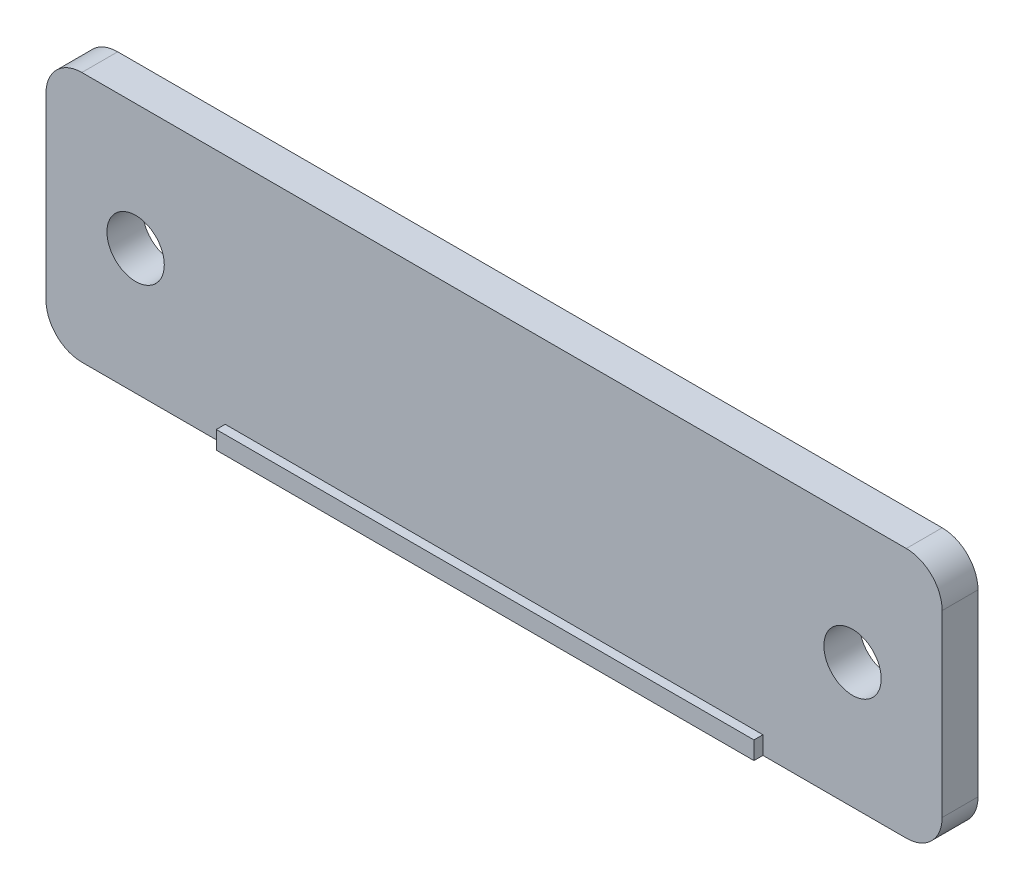
from build123d import *

# Parameters (mm, degrees)
SKETCH2_W           = 50
SKETCH2_H           = 14
BOSS_EXTRUDE1_DEPTH = 2.5
SKETCH4_OUTSIDE_W   = 62.396
SKETCH4_OUTSIDE_H   = 26.396
SKETCH4_OUTSIDE_W_2 = 30
SKETCH4_OUTSIDE_H_2 = 1
CUT_EXTRUDE1_DEPTH  = 0.5
SKETCH5_R           = 1.6
CUT_EXTRUDE2_DEPTH  = 2
FILLET2_R           = 2


with BuildPart() as part:
    # Sketch2 → Boss-Extrude1 (new body)
    with BuildSketch(Plane.XY):
        Rectangle(SKETCH2_W, SKETCH2_H)
    extrude(amount=BOSS_EXTRUDE1_DEPTH)

    # Sketch4 outside → Cut-Extrude1 (cut)
    with BuildSketch(Plane.XY.offset(2.5)):
        Rectangle(SKETCH4_OUTSIDE_W, SKETCH4_OUTSIDE_H)
        with Locations((0, -6.5)):
            Rectangle(SKETCH4_OUTSIDE_W_2, SKETCH4_OUTSIDE_H_2, mode=Mode.SUBTRACT)
    extrude(amount=-CUT_EXTRUDE1_DEPTH, mode=Mode.SUBTRACT)

    # Sketch5 → Cut-Extrude2 (cut)
    with BuildSketch(Plane.XY.offset(2)):
        with Locations((-20, 0)):
            Circle(SKETCH5_R)
        with Locations((20, 0)):
            Circle(SKETCH5_R)
    extrude(amount=-CUT_EXTRUDE2_DEPTH, mode=Mode.SUBTRACT)

    # Fillet2
    fillet2_edges = [part.edges().sort_by_distance(p)[0] for p in [
        (25, -7, 1),
        (-25, -7, 1),
        (-25, 7, 1),
        (25, 7, 1),
    ]]
    fillet(fillet2_edges, radius=FILLET2_R)


solid = part.part
